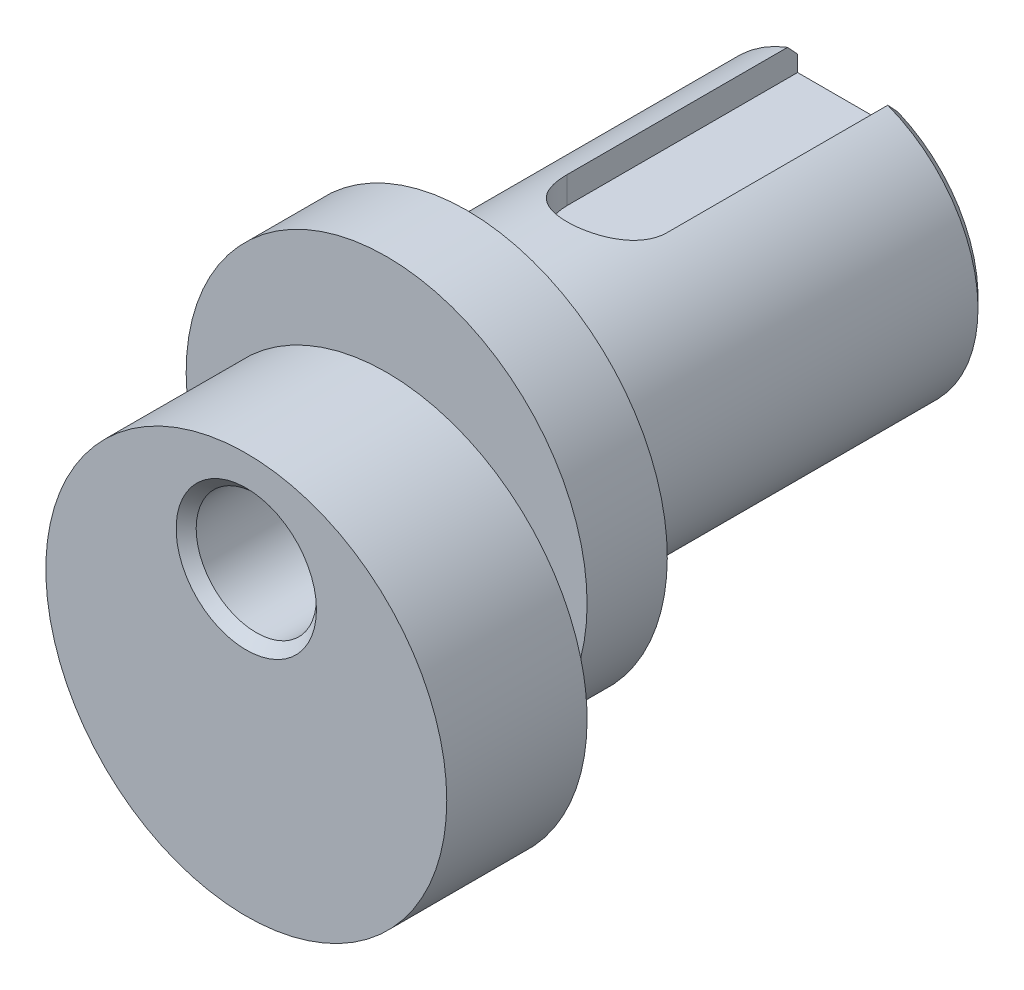
from build123d import *

# Parameters (mm, degrees)
SKETCH1_R           = 10
BOSS_EXTRUDE1_DEPTH = 7
SKETCH2_R           = 10
BOSS_EXTRUDE2_DEPTH = 4
SKETCH3_R           = 7
BOSS_EXTRUDE3_DEPTH = 19
CUT_EXTRUDE5_START  = 10.2
CUT_EXTRUDE5_DEPTH  = 10.2
CHAMFER2_SIZE       = 0.5
SKETCH11_R          = 3
CUT_EXTRUDE6_DEPTH  = 36
CHAMFER3_SIZE       = 0.5


with BuildPart() as part:
    # Sketch1 → Boss-Extrude1 (new body)
    with BuildSketch(Plane.XY):
        Circle(SKETCH1_R)
    extrude(amount=-BOSS_EXTRUDE1_DEPTH)

    # Sketch2 → Boss-Extrude2 (add)
    with BuildSketch(Plane(origin=(0, 0, -7), x_dir=(-1, 0, 0), z_dir=(0, 0, -1))):
        with Locations(Location((0, 5, 0), (0, 0, 194.477512186))):
            Circle(SKETCH2_R)
    extrude(amount=BOSS_EXTRUDE2_DEPTH)

    # Sketch3 → Boss-Extrude3 (add)
    with BuildSketch(Plane(origin=(0, 0, -11), x_dir=(-1, 0, 0), z_dir=(0, 0, -1))):
        with Locations((0, 5)):
            Circle(SKETCH3_R)
    extrude(amount=BOSS_EXTRUDE3_DEPTH)

    # Sketch9 → Cut-Extrude5 (cut)
    with BuildSketch(Plane(origin=(0, 0, 0), x_dir=(1, 0, 0), z_dir=(0, 1, 0)).offset(CUT_EXTRUDE5_START)):
        with BuildLine():
            Line((2.5, 18.5), (2.5, 30))
            Line((2.5, 30), (-2.5, 30))
            Line((-2.5, 30), (-2.5, 18.5))
            ThreePointArc((-2.5, 18.5), (0, 16), (2.5, 18.5))
        make_face()
    extrude(amount=CUT_EXTRUDE5_DEPTH, mode=Mode.SUBTRACT)

    # Chamfer2
    chamfer2_edges = [part.edges().sort_by_distance(p)[0] for p in [
        (3.968626967, -0.766281297, -30),
    ]]
    chamfer(chamfer2_edges, length=CHAMFER2_SIZE)

    # Sketch11 → Cut-Extrude6 (cut, through all)
    with BuildSketch(Plane(origin=(0, 0, -30), x_dir=(-1, 0, 0), z_dir=(0, 0, -1))):
        with Locations((0, 5)):
            Circle(SKETCH11_R)
    extrude(amount=-CUT_EXTRUDE6_DEPTH, mode=Mode.SUBTRACT)

    # Chamfer3
    chamfer3_edges = [part.edges().sort_by_distance(p)[0] for p in [
        (3, 5, 0),
        (3, 5, -30),
    ]]
    chamfer(chamfer3_edges, length=CHAMFER3_SIZE)


solid = part.part
